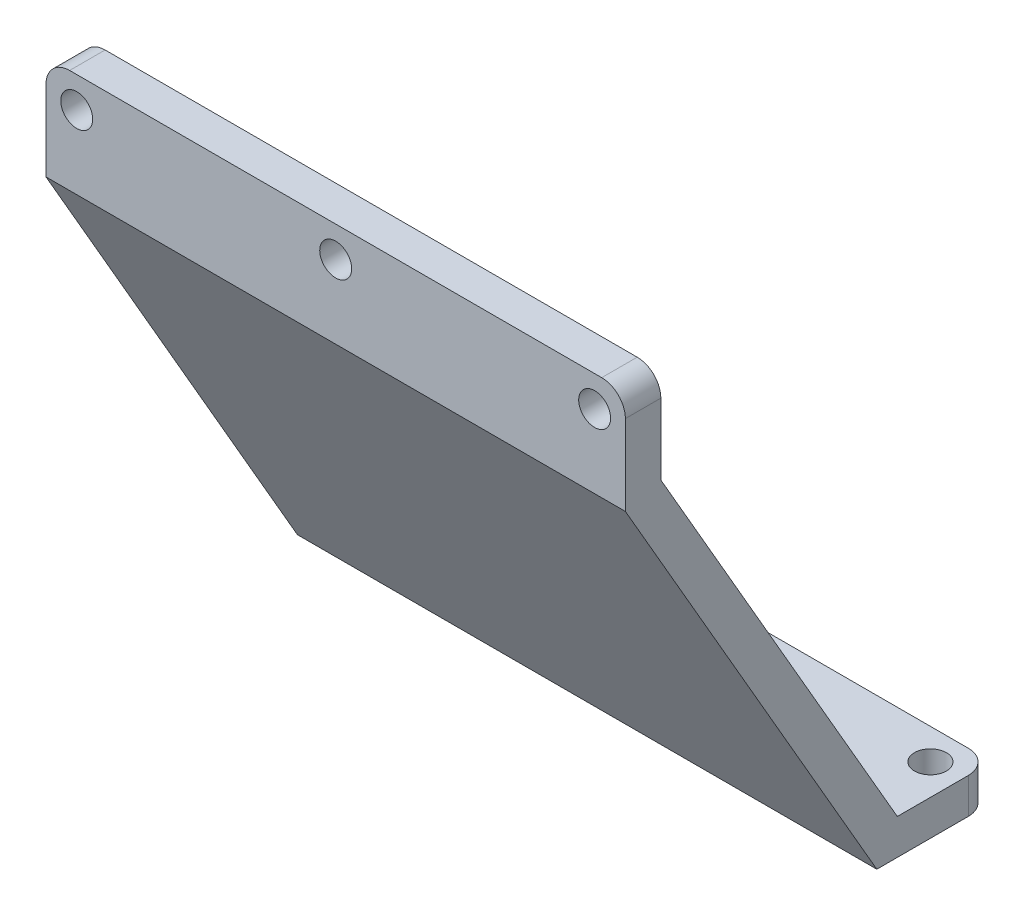
from build123d import *

# Parameters (mm, degrees)
ESBO_O1_W                = 49
ESBO_O1_H                = 45.64
RESSALTO_EXTRUS_O1_DEPTH = 31
CORTE_EXTRUS_O1_DEPTH    = 63.311735652
CORTE_EXTRUS_O2_DEPTH    = 63.311735652
ESBO_O5_R                = 1.35
CORTE_EXTRUS_O4_DEPTH    = 59.132775609
ESBO_O6_R                = 1.35
CORTE_EXTRUS_O5_DEPTH    = 44.646333179
FILETE1_R                = 2


with BuildPart() as part:
    # Esboço1 → Ressalto-extrusão1 (new body)
    with BuildSketch(Plane.XY):
        Rectangle(ESBO_O1_W, ESBO_O1_H)
    extrude(amount=RESSALTO_EXTRUS_O1_DEPTH)

    # Esboço2 → Corte-extrusão1 (cut, through all)
    with BuildSketch(Plane.ZY.offset(24.5)):
        Polygon((9.732649273, -22.82), (31, -22.82), (31, 14.022250108), align=None)
    extrude(amount=-CORTE_EXTRUS_O1_DEPTH, mode=Mode.SUBTRACT)

    # Esboço3 → Corte-extrusão2 (cut, through all)
    with BuildSketch(Plane.ZY.offset(24.5)):
        Polygon((0, -19.82), (8, -19.82), (28, 14.82), (28, 22.82), (0, 22.82), align=None)
    extrude(amount=-CORTE_EXTRUS_O2_DEPTH, mode=Mode.SUBTRACT)

    # Esboço5 → Corte-extrusão4 (cut, through all)
    with BuildSketch(Plane(origin=(0, -19.82, 0), x_dir=(1, 0, 0), z_dir=(0, 1, 0))):
        with Locations(Location((21.9, -2.6, 0), (0, 0, 180))):
            Circle(ESBO_O5_R)
        with Locations(Location((0, -2.6, 0), (0, 0, 180))):
            Circle(ESBO_O5_R)
        with Locations(Location((-21.9, -2.6, 0), (0, 0, 180))):
            Circle(ESBO_O5_R)
    extrude(amount=-CORTE_EXTRUS_O4_DEPTH, mode=Mode.SUBTRACT)

    # Esboço6 → Corte-extrusão5 (cut, through all)
    with BuildSketch(Plane(origin=(0, 0, 28), x_dir=(-1, 0, 0), z_dir=(0, 0, -1))):
        with Locations((21.9, 20.22)):
            Circle(ESBO_O6_R)
        with Locations((0, 20.22)):
            Circle(ESBO_O6_R)
        with Locations((-21.9, 20.22)):
            Circle(ESBO_O6_R)
    extrude(amount=-CORTE_EXTRUS_O5_DEPTH, mode=Mode.SUBTRACT)

    # Filete1
    filete1_edges = [part.edges().sort_by_distance(p)[0] for p in [
        (-24.5, -21.32, 0),
        (24.5, -21.32, 0),
        (-24.5, 22.82, 29.5),
        (24.5, 22.82, 29.5),
    ]]
    fillet(filete1_edges, radius=FILETE1_R)


solid = part.part
